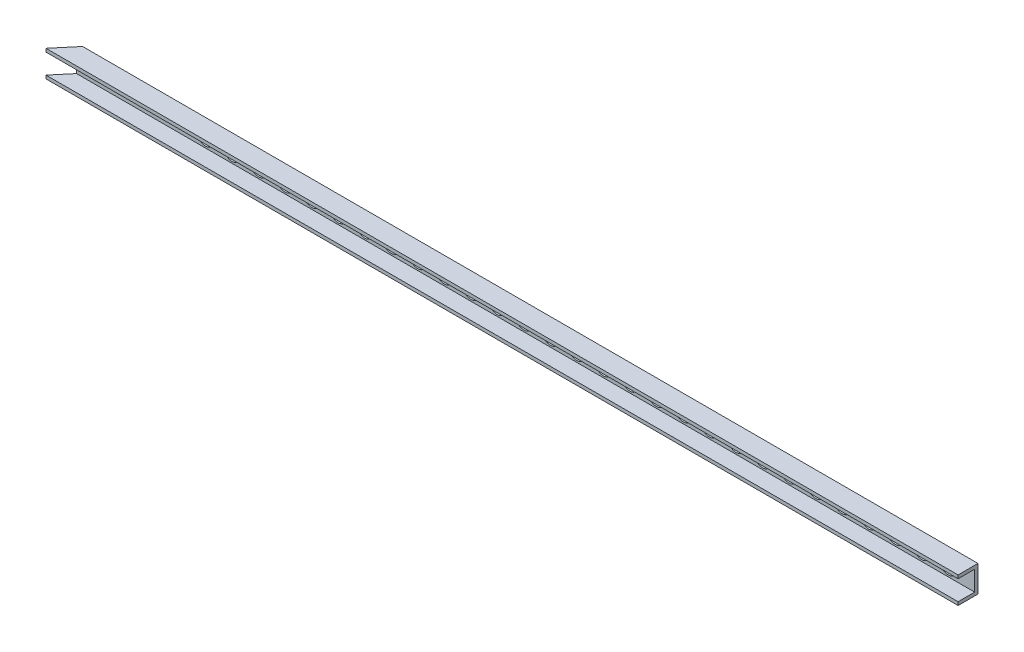
from build123d import *

# Parameters (mm, degrees)
BOSS_EXTRUDE1_DEPTH      = 254
BOSS_EXTRUDE1_DEPTH_BACK = 185.42
SKETCH1_W                = 12.7
SKETCH1_H                = 12.7
SKETCH1_W_2              = 9.525
SKETCH1_H_2              = 9.525
CUT_EXTRUDE1_DEPTH       = 255.158700422
CUT_EXTRUDE1_DEPTH_BACK  = 255.158700422
SKETCH4_R                = 3.96875
CUT_EXTRUDE3_DEPTH       = 255.396565425
SKETCH5_W                = 3.175
SKETCH5_H                = 13.97
CUT_EXTRUDE4_DEPTH       = 440.511753426


with BuildPart() as part:
    # Sketch1 → Boss-Extrude1 (new, two sides: drawn at the far end of the back side and taken through both)
    with BuildSketch(Plane(origin=(0, 0, 0), x_dir=(0, 0, -1), z_dir=(1, 0, 0)).offset(-BOSS_EXTRUDE1_DEPTH_BACK)):
        Rectangle(SKETCH1_W, SKETCH1_H)
        Rectangle(SKETCH1_W_2, SKETCH1_H_2, mode=Mode.SUBTRACT)
    extrude(amount=BOSS_EXTRUDE1_DEPTH + BOSS_EXTRUDE1_DEPTH_BACK)

    # Sketch2 → Cut-Extrude1 (cut, two sides: drawn at the far end of the back side and taken through both)
    with BuildSketch(Plane(origin=(0, 0, 0), x_dir=(1, 0, 0), z_dir=(0, 1, 0)).offset(-CUT_EXTRUDE1_DEPTH_BACK)):
        Polygon((-185.42, -6.35), (-174.250456919, 6.961343094), (-183.078216502, 14.368712905), (-194.247759583, 1.057369811), align=None)
    extrude(amount=CUT_EXTRUDE1_DEPTH + CUT_EXTRUDE1_DEPTH_BACK, mode=Mode.SUBTRACT)

    # Sketch4 → Cut-Extrude3 (cut, through all)
    with BuildSketch(Plane.XY.offset(6.35)):
        with Locations((241.3, 0)):
            Circle(SKETCH4_R)
        with Locations((228.6, 0)):
            Circle(SKETCH4_R)
        with Locations((215.9, 0)):
            Circle(SKETCH4_R)
        with Locations((203.2, 0)):
            Circle(SKETCH4_R)
        with Locations((190.5, 0)):
            Circle(SKETCH4_R)
        with Locations((177.8, 0)):
            Circle(SKETCH4_R)
        with Locations((165.1, 0)):
            Circle(SKETCH4_R)
        with Locations((152.4, 0)):
            Circle(SKETCH4_R)
        with Locations((139.7, 0)):
            Circle(SKETCH4_R)
        with Locations((127, 0)):
            Circle(SKETCH4_R)
        with Locations((114.3, 0)):
            Circle(SKETCH4_R)
        with Locations((101.6, 0)):
            Circle(SKETCH4_R)
        with Locations((88.9, 0)):
            Circle(SKETCH4_R)
        with Locations((76.2, 0)):
            Circle(SKETCH4_R)
        with Locations((63.5, 0)):
            Circle(SKETCH4_R)
        with Locations((50.8, 0)):
            Circle(SKETCH4_R)
        with Locations((38.1, 0)):
            Circle(SKETCH4_R)
        with Locations((25.4, 0)):
            Circle(SKETCH4_R)
        with Locations((12.7, 0)):
            Circle(SKETCH4_R)
        Circle(SKETCH4_R)
        with Locations((-12.7, 0)):
            Circle(SKETCH4_R)
        with Locations((-25.4, 0)):
            Circle(SKETCH4_R)
        with Locations((-38.1, 0)):
            Circle(SKETCH4_R)
        with Locations((-50.8, 0)):
            Circle(SKETCH4_R)
        with Locations((-63.5, 0)):
            Circle(SKETCH4_R)
        with Locations((-76.2, 0)):
            Circle(SKETCH4_R)
        with Locations((-88.9, 0)):
            Circle(SKETCH4_R)
        with Locations((-101.6, 0)):
            Circle(SKETCH4_R)
        with Locations((-114.3, 0)):
            Circle(SKETCH4_R)
    extrude(amount=-CUT_EXTRUDE3_DEPTH, mode=Mode.SUBTRACT)

    # Sketch5 → Cut-Extrude4 (cut, through all)
    with BuildSketch(Plane(origin=(254, 0, 0), x_dir=(0, 0, -1), z_dir=(1, 0, 0))):
        with Locations((-4.7625, 0)):
            Rectangle(SKETCH5_W, SKETCH5_H)
    extrude(amount=-CUT_EXTRUDE4_DEPTH, mode=Mode.SUBTRACT)


solid = part.part
